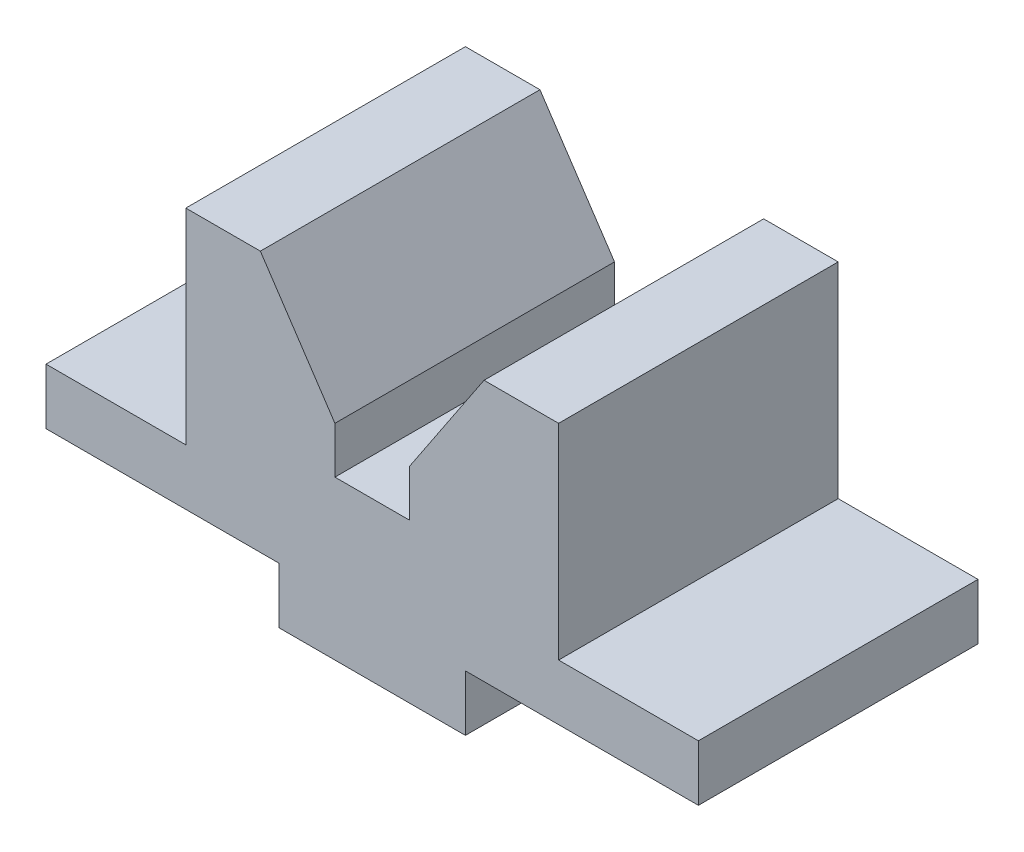
from build123d import *

# Parameters (mm, degrees)
BOSS_EXTRUDE1_DEPTH = 15


with BuildPart() as part:
    # Sketch1 → Boss-Extrude1 (new, symmetric)
    with BuildSketch(Plane.XY):
        Polygon((-10, 0), (10, 0), (10, 6), (35, 6), (35, 12), (20, 12), (20, 34), (12, 34), (4, 22), (4, 17), (-4, 17), (-4, 22), (-12, 34), (-20, 34), (-20, 12), (-35, 12), (-35, 6), (-10, 6), align=None)
    extrude(amount=BOSS_EXTRUDE1_DEPTH, both=True)


solid = part.part
